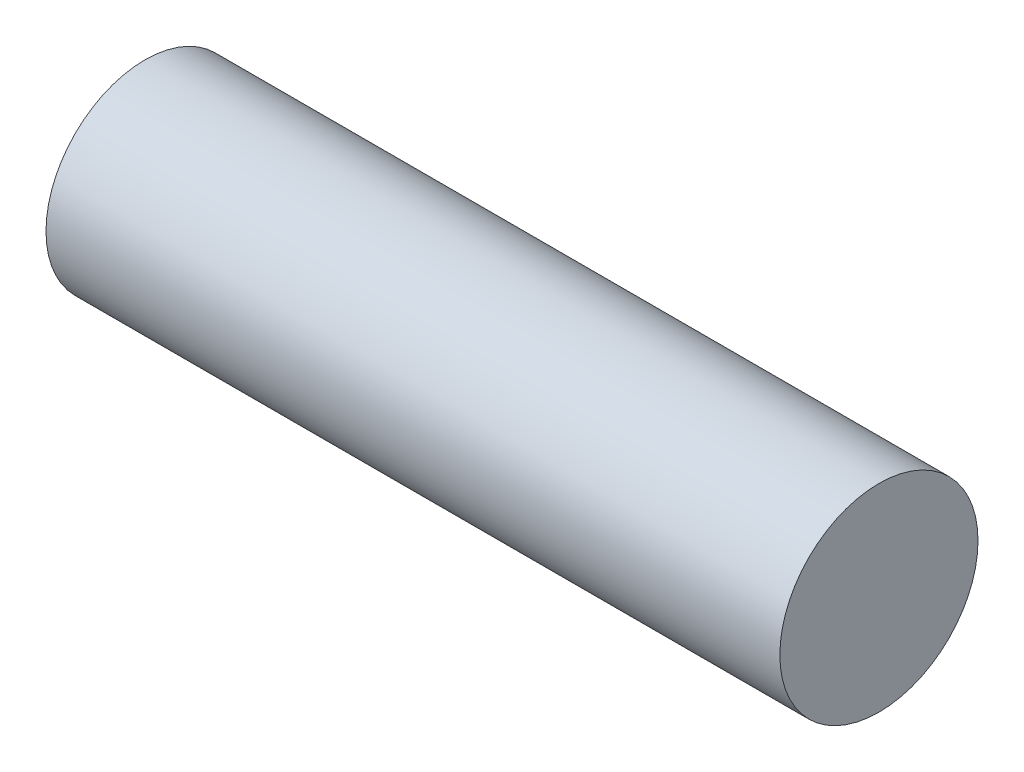
from build123d import *

# Parameters (mm, degrees)
SKETCH1_R           = 13.5
BOSS_EXTRUDE1_DEPTH = 50
SKETCH2_R           = 1.25
CUT_EXTRUDE1_DEPTH  = 4


with BuildPart() as part:
    # Sketch1 → Boss-Extrude1 (new, symmetric)
    with BuildSketch(Plane(origin=(0, 0, 0), x_dir=(0, 0, -1), z_dir=(1, 0, 0))):
        Circle(SKETCH1_R)
    extrude(amount=BOSS_EXTRUDE1_DEPTH, both=True)

    # Sketch2 → Cut-Extrude1 (cut)
    with BuildSketch(Plane.ZY.offset(50)):
        with Locations((0, 10)):
            Circle(SKETCH2_R)
        with Locations((8.660254038, 5)):
            Circle(SKETCH2_R)
        with Locations((8.660254038, -5)):
            Circle(SKETCH2_R)
        with Locations((0, -10)):
            Circle(SKETCH2_R)
        with Locations((-8.660254038, -5)):
            Circle(SKETCH2_R)
        with Locations((-8.660254038, 5)):
            Circle(SKETCH2_R)
    extrude(amount=-CUT_EXTRUDE1_DEPTH, mode=Mode.SUBTRACT)


solid = part.part
